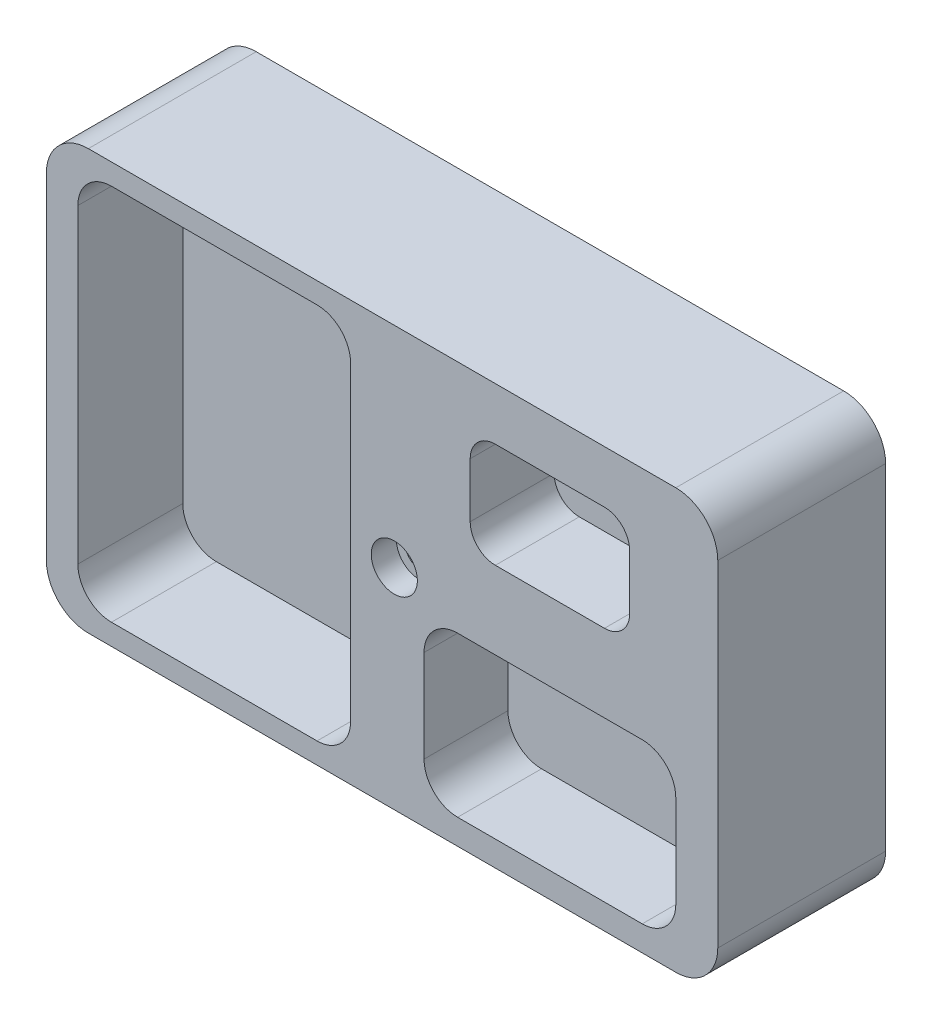
from build123d import *

# Parameters (mm, degrees)
SKETCH1_W                      = 160
SKETCH1_H                      = 100
BOSS_EXTRUDE1_DEPTH            = 40
SKETCH2_W                      = 65
SKETCH2_H                      = 90
CUT_EXTRUDE1_DEPTH             = 25
FILLET1_R                      = 8
SKETCH3_W                      = 60
SKETCH3_H                      = 38
SKETCH3_W_2                    = 38
SKETCH3_H_2                    = 25
CUT_EXTRUDE2_DEPTH             = 20
FILLET2_R                      = 6
FILLET3_R                      = 8
FILLET4_R                      = 10
CBORE_FOR_M6_SHCS1_D           = 6.6
CBORE_FOR_M6_SHCS1_CBORE_D     = 11
CBORE_FOR_M6_SHCS1_CBORE_DEPTH = 6


with BuildPart() as part:
    # Sketch1 → Boss-Extrude1 (new body)
    with BuildSketch(Plane.XY):
        Rectangle(SKETCH1_W, SKETCH1_H)
    extrude(amount=-BOSS_EXTRUDE1_DEPTH)

    # Sketch2 → Cut-Extrude1 (cut)
    with BuildSketch(Plane.XY):
        with Locations((-40, 0)):
            Rectangle(SKETCH2_W, SKETCH2_H)
    extrude(amount=-CUT_EXTRUDE1_DEPTH, mode=Mode.SUBTRACT)

    # Fillet1
    fillet1_edges = [part.edges().sort_by_distance(p)[0] for p in [
        (-7.5, 45, -12.5),
        (-7.5, -45, -12.5),
        (-72.5, -45, -12.5),
        (-72.5, 45, -12.5),
    ]]
    fillet(fillet1_edges, radius=FILLET1_R)

    # Sketch3 → Cut-Extrude2 (cut)
    with BuildSketch(Plane.XY):
        with Locations((40, -25)):
            Rectangle(SKETCH3_W, SKETCH3_H)
        with Locations((40, 25)):
            Rectangle(SKETCH3_W_2, SKETCH3_H_2)
    extrude(amount=-CUT_EXTRUDE2_DEPTH, mode=Mode.SUBTRACT)

    # Fillet2
    fillet2_edges = [part.edges().sort_by_distance(p)[0] for p in [
        (59, 37.5, -10),
        (59, 12.5, -10),
        (21, 12.5, -10),
        (21, 37.5, -10),
    ]]
    fillet(fillet2_edges, radius=FILLET2_R)

    # Fillet3
    fillet3_edges = [part.edges().sort_by_distance(p)[0] for p in [
        (70, -6, -10),
        (70, -44, -10),
        (10, -44, -10),
        (10, -6, -10),
    ]]
    fillet(fillet3_edges, radius=FILLET3_R)

    # Fillet4
    fillet4_edges = [part.edges().sort_by_distance(p)[0] for p in [
        (80, -50, -20),
        (-80, -50, -20),
        (-80, 50, -20),
        (80, 50, -20),
    ]]
    fillet(fillet4_edges, radius=FILLET4_R)

    # CBORE for M6 SHCS1 (through all)
    with Locations(Plane.XY):
        with Locations((2.910260727, 0)):
            CounterBoreHole(CBORE_FOR_M6_SHCS1_D / 2, CBORE_FOR_M6_SHCS1_CBORE_D / 2, CBORE_FOR_M6_SHCS1_CBORE_DEPTH)


solid = part.part
